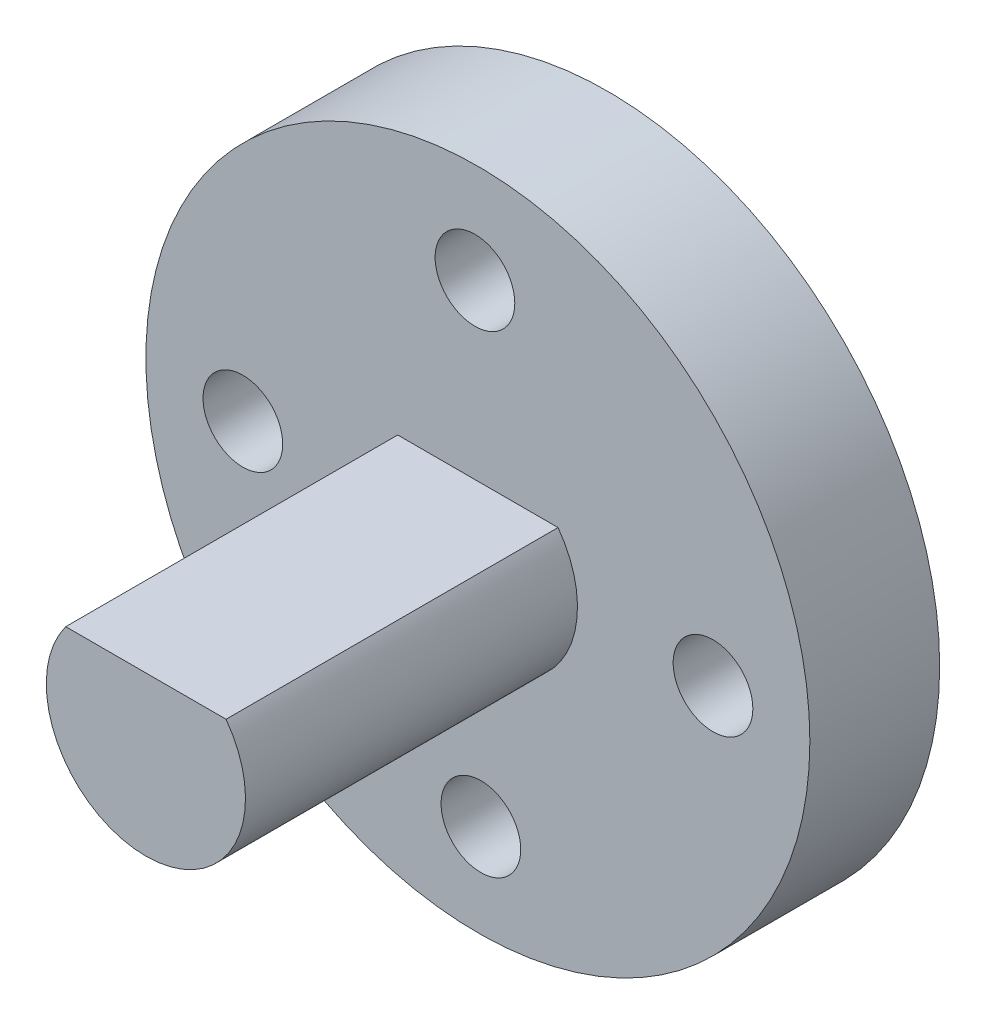
from build123d import *

# Parameters (mm, degrees)
ESQUISSE1_R                  = 10
BOSS_EXTRU_1_DEPTH           = 3.91
D_GAGEMENT_M21_D             = 2.4
R_P_TITION_CIRCULAIRE1_COUNT = 4
ESQUISSE4_R                  = 3
BOSS_EXTRU_2_DEPTH           = 10
ESQUISSE5_W                  = 6
ESQUISSE5_H                  = 1.22
ENL_V_MAT_EXTRU_1_DEPTH      = 10
ESQUISSE6_R                  = 4
ENL_V_MAT_EXTRU_2_DEPTH      = 1.91


with BuildPart() as part:
    # Esquisse1 → Boss.-Extru.1 (new body)
    with BuildSketch(Plane.XY):
        Circle(ESQUISSE1_R)
    extrude(amount=BOSS_EXTRU_1_DEPTH)

    # Dégagement M21 (through all)
    with Locations(Plane(origin=(-0.088339646, 6.978832002, 3.91), x_dir=(1, 0, 0), z_dir=(0, 0, 1))):
        with Locations((0, 0)):
            d_gagement_m21 = Hole(D_GAGEMENT_M21_D / 2)

    # Répétition circulaire1: Dégagement M21 ×4 about axis
    r_p_tition_circulaire1_axis = Axis((0.001290677, -0.101963455, 0), (0, 0, 1))
    for i in range(1, R_P_TITION_CIRCULAIRE1_COUNT):
        add(d_gagement_m21.rotate(r_p_tition_circulaire1_axis, i * 360 / R_P_TITION_CIRCULAIRE1_COUNT), mode=Mode.SUBTRACT)

    # Esquisse4 → Boss.-Extru.2 (add)
    with BuildSketch(Plane.XY.offset(3.91)):
        Circle(ESQUISSE4_R)
    extrude(amount=BOSS_EXTRU_2_DEPTH)

    # Esquisse5 → Enlèv. mat.-Extru.1 (cut)
    with BuildSketch(Plane.XY.offset(13.91)):
        with Locations((0, 2.39)):
            Rectangle(ESQUISSE5_W, ESQUISSE5_H)
    extrude(amount=-ENL_V_MAT_EXTRU_1_DEPTH, mode=Mode.SUBTRACT)

    # Esquisse6 → Enlèv. mat.-Extru.2 (cut)
    with BuildSketch(Plane(origin=(0, 0, 0), x_dir=(-1, 0, 0), z_dir=(0, 0, -1))):
        Circle(ESQUISSE6_R)
    extrude(amount=-ENL_V_MAT_EXTRU_2_DEPTH, mode=Mode.SUBTRACT)


solid = part.part
